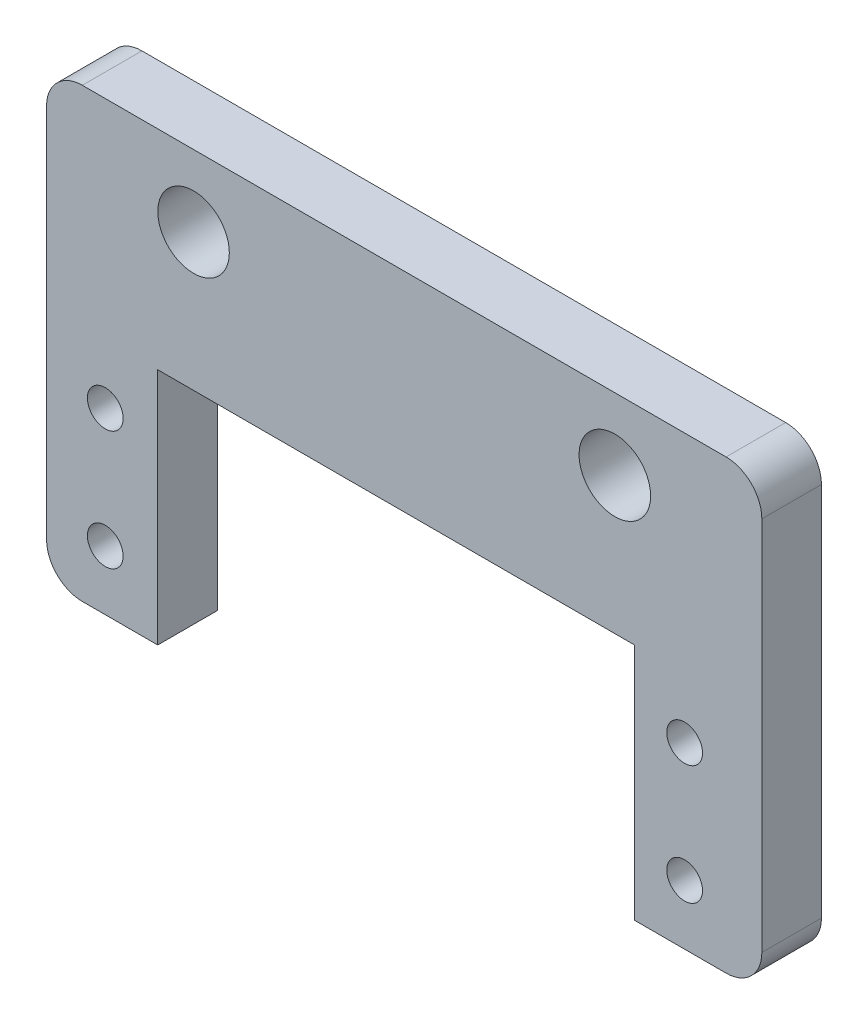
from build123d import *

# Parameters (mm, degrees)
SKETCH_1_R          = 1.5
EXTRUDE_1_DEPTH     = 5
SKETCH_2_R          = 3
CUT_EXTRUDE_1_DEPTH = 10


with BuildPart() as part:
    # 草图1 → 凸台-拉伸1 (new body)
    with BuildSketch(Plane.XY):
        with BuildLine():
            Line((-15.5, 27.5), (38.5, 27.5))
            ThreePointArc((38.5, 27.5), (40.621320344, 26.621320344), (41.5, 24.5))
            Line((41.5, 24.5), (41.5, -7))
            ThreePointArc((41.5, -7), (40.621320344, -9.121320344), (38.5, -10))
            Line((38.5, -10), (33.3, -10))
            Line((33.3, -10), (30.825, -10))
            Line((30.825, -10), (30.825, 10))
            Line((30.825, 10), (-9.175, 10))
            Line((-9.175, 10), (-9.175, -10))
            Line((-9.175, -10), (-15.5, -10))
            ThreePointArc((-15.5, -10), (-17.621320344, -9.121320344), (-18.5, -7))
            Line((-18.5, -7), (-18.5, 24.5))
            ThreePointArc((-18.5, 24.5), (-17.621320344, 26.621320344), (-15.5, 27.5))
        make_face()
        with Locations((-13.575, 5)):
            Circle(SKETCH_1_R, mode=Mode.SUBTRACT)
        with Locations((-13.575, -5)):
            Circle(SKETCH_1_R, mode=Mode.SUBTRACT)
        with Locations((35.025, 5)):
            Circle(SKETCH_1_R, mode=Mode.SUBTRACT)
        with Locations((35.025, -5)):
            Circle(SKETCH_1_R, mode=Mode.SUBTRACT)
    extrude(amount=EXTRUDE_1_DEPTH)

    # 草图2 → 切除-拉伸1 (cut)
    with BuildSketch(Plane.XY.offset(5)):
        with Locations((-6.17, 21.5)):
            Circle(SKETCH_2_R)
        with Locations((29.17, 21.5)):
            Circle(SKETCH_2_R)
    extrude(amount=-CUT_EXTRUDE_1_DEPTH, mode=Mode.SUBTRACT)


solid = part.part
